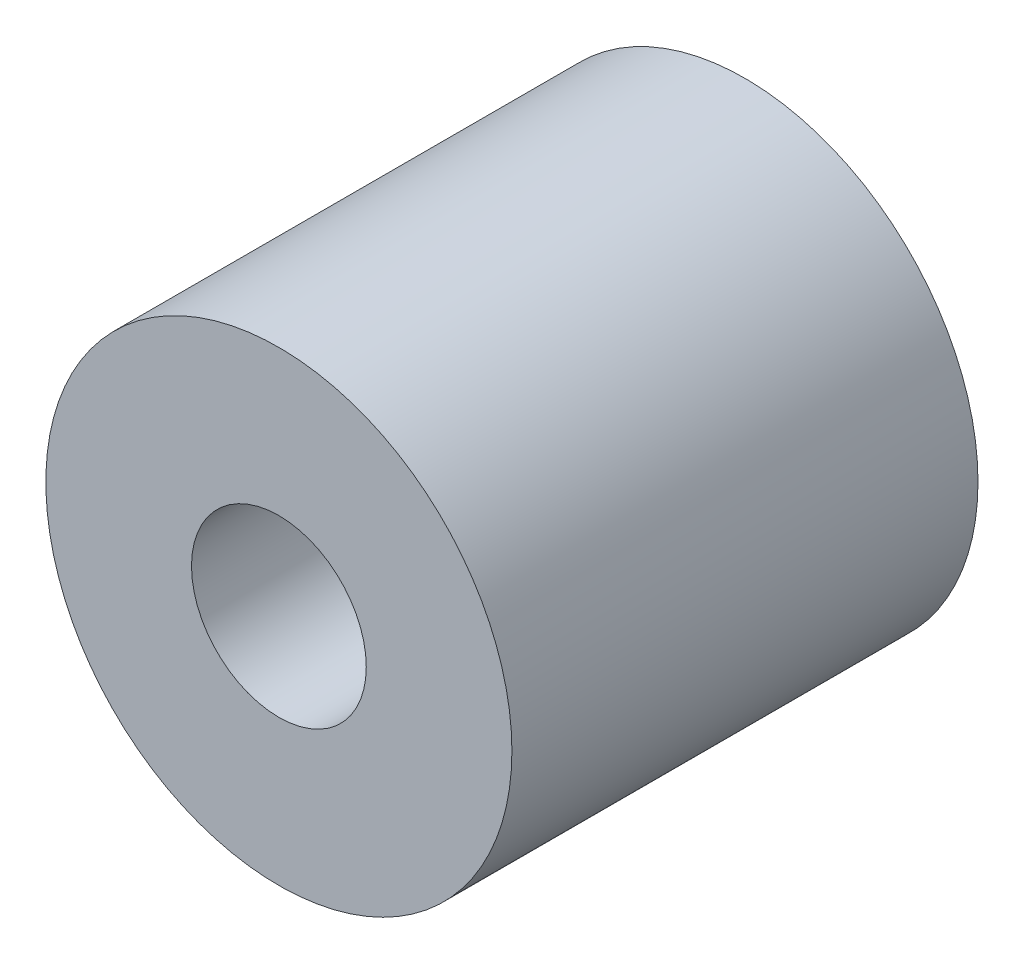
from build123d import *

# Parameters (mm, degrees)
SKETCH1_R           = 4
SKETCH1_R_2         = 3.075
BOSS_EXTRUDE1_DEPTH = 8
BOSS_EXTRUDE2_START = -5.5
SKETCH2_R           = 3.075
SKETCH2_R_2         = 1.5
BOSS_EXTRUDE2_DEPTH = 5.5
CHAMFER1_SIZE       = 0.2


with BuildPart() as part:
    # Sketch1 → Boss-Extrude1 (new body)
    with BuildSketch(Plane.XY):
        Circle(SKETCH1_R)
        Circle(SKETCH1_R_2, mode=Mode.SUBTRACT)
    extrude(amount=BOSS_EXTRUDE1_DEPTH)

    # Sketch2 → Boss-Extrude2 (add)
    with BuildSketch(Plane.XY.offset(8).offset(BOSS_EXTRUDE2_START)):
        Circle(SKETCH2_R)
        Circle(SKETCH2_R_2, mode=Mode.SUBTRACT)
    extrude(amount=BOSS_EXTRUDE2_DEPTH)

    # Chamfer1
    chamfer1_edges = [part.edges().sort_by_distance(p)[0] for p in [
        (-3.075, 0, 0),
    ]]
    chamfer(chamfer1_edges, length=CHAMFER1_SIZE)


solid = part.part
